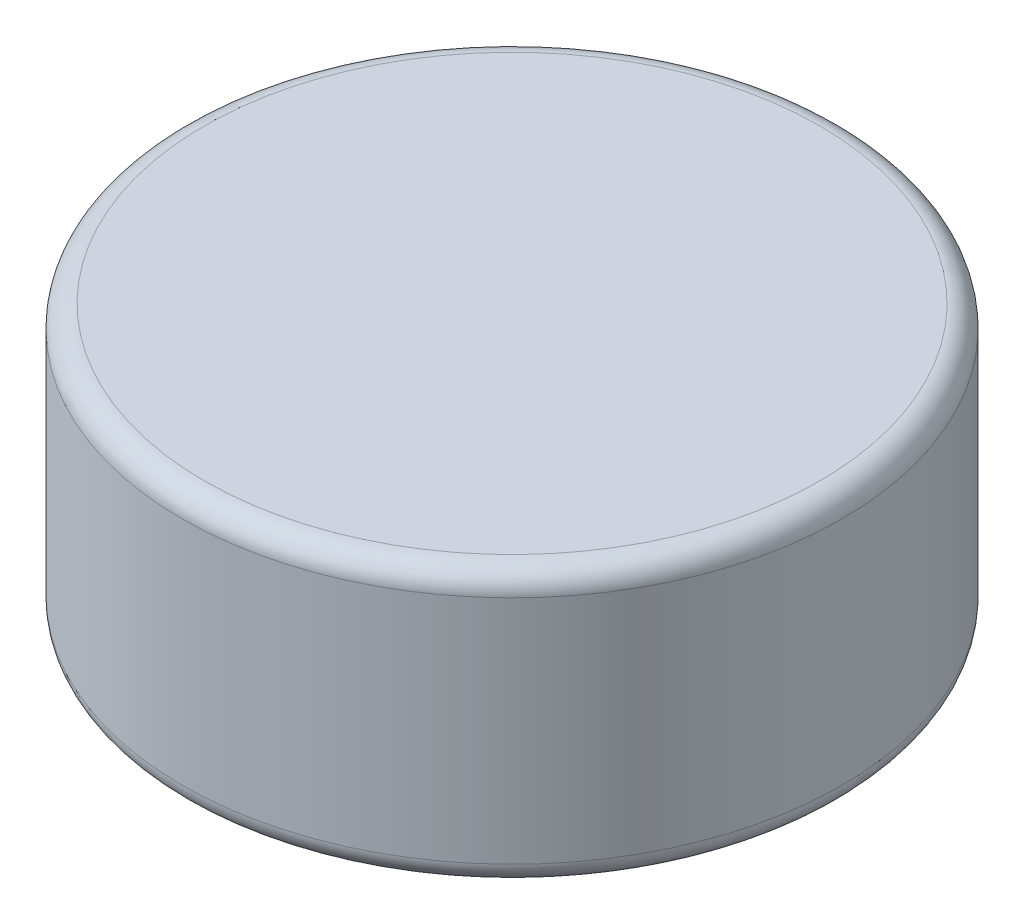
from build123d import *

# Parameters (mm, degrees)
SKETCH1_R           = 3
BOSS_EXTRUDE1_DEPTH = 1.25
FILLET1_R           = 0.2


with BuildPart() as part:
    # Sketch1 → Boss-Extrude1 (new, symmetric)
    with BuildSketch(Plane(origin=(0, 0, 0), x_dir=(1, 0, 0), z_dir=(0, 1, 0))):
        with Locations(Location((0, 0, 0), (0, 0, 270))):
            Circle(SKETCH1_R)
    extrude(amount=BOSS_EXTRUDE1_DEPTH, both=True)

    # Fillet1
    fillet1_edges = [part.edges().sort_by_distance(p)[0] for p in [
        (0, -1.25, -3),
        (0, 1.25, -3),
    ]]
    fillet(fillet1_edges, radius=FILLET1_R)


solid = part.part
